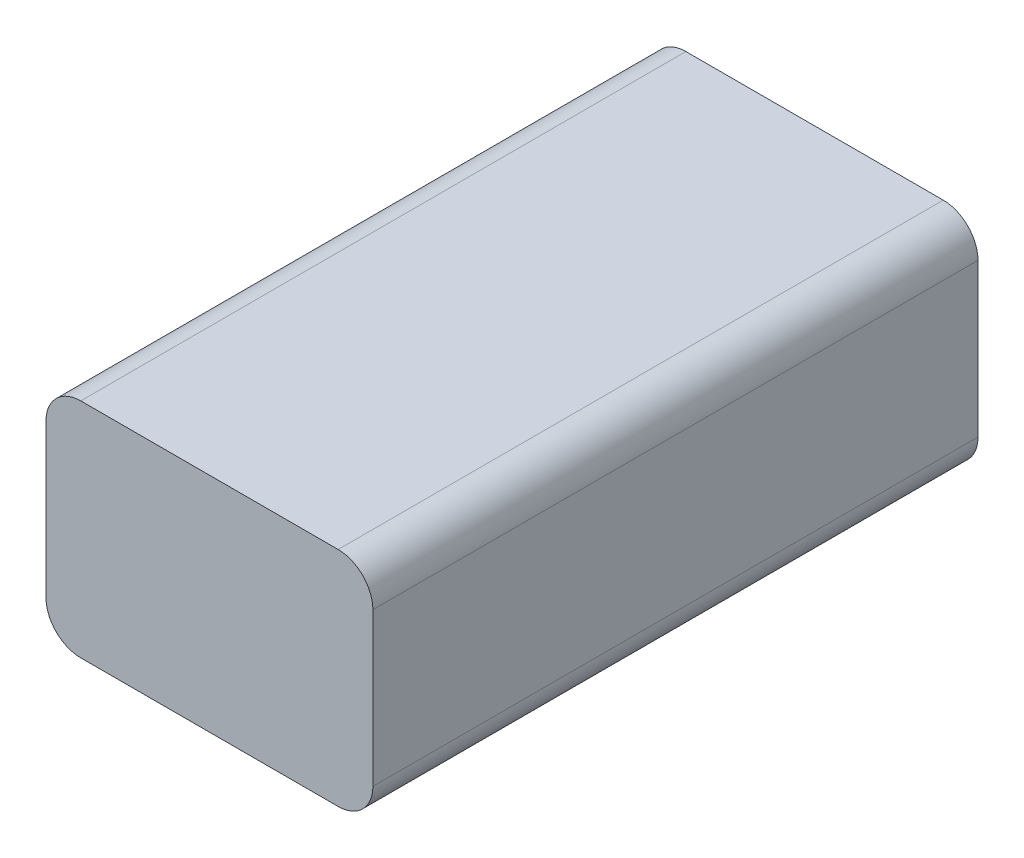
from build123d import *

# Parameters (mm, degrees)
SKETCH1_W           = 47
SKETCH1_H           = 32
BOSS_EXTRUDE1_DEPTH = 87
FILLET1_R           = 5


with BuildPart() as part:
    # Sketch1 → Boss-Extrude1 (new body)
    with BuildSketch(Plane.XY):
        Rectangle(SKETCH1_W, SKETCH1_H)
    extrude(amount=BOSS_EXTRUDE1_DEPTH)

    # Fillet1
    fillet1_edges = [part.edges().sort_by_distance(p)[0] for p in [
        (-23.5, 16, 43.5),
        (23.5, 16, 43.5),
        (23.5, -16, 43.5),
        (-23.5, -16, 43.5),
    ]]
    fillet(fillet1_edges, radius=FILLET1_R)


solid = part.part
